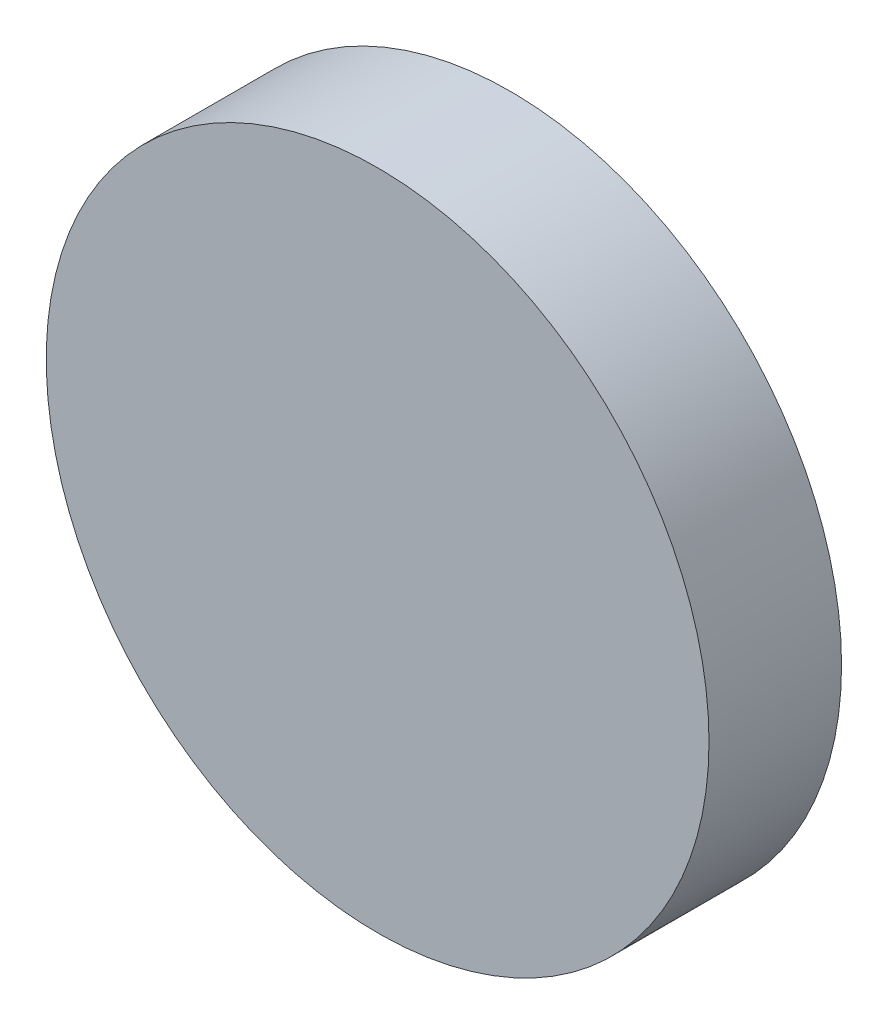
from build123d import *

# Parameters (mm, degrees)
SKETCH1_R     = 2.5
PROFILE_DEPTH = 1


with BuildPart() as part:
    # Sketch1 → Profile (new body)
    with BuildSketch(Plane.XY):
        with Locations((2.5, 2.5)):
            Circle(SKETCH1_R)
    extrude(amount=PROFILE_DEPTH)


solid = part.part
